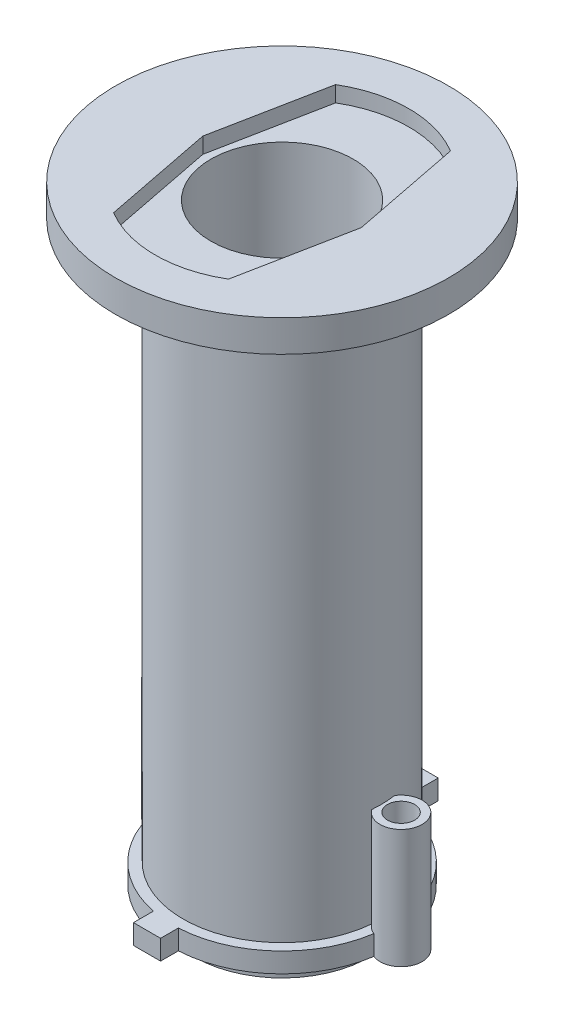
from build123d import *

# Parameters (mm, degrees)
BOSS_EXTRUDE1_DEPTH = 2.5
CUT_EXTRUDE1_REACH  = 26.645
SKETCH2_R           = 1.715
SKETCH2_R_2         = 8.98
SKETCH3_R           = 2.6543
BOSS_EXTRUDE2_DEPTH = 70.305
BOSS_EXTRUDE3_START = 4
SKETCH4_R           = 21
SKETCH4_R_2         = 8.98
BOSS_EXTRUDE3_DEPTH = 4
SKETCH6_R           = 21
SKETCH6_R_2         = 8.98
BOSS_EXTRUDE4_DEPTH = 2
CUT_EXTRUDE3_START  = -15
SKETCH7_R           = 1.715
CUT_EXTRUDE3_DEPTH  = 15
SKETCH8_R           = 8.98
CUT_EXTRUDE4_DEPTH  = 2
SKETCH9_R           = 11.0744
SKETCH9_R_2         = 8.98
BOSS_EXTRUDE5_DEPTH = 2.35
BOSS_EXTRUDE6_REACH = 82.451
SKETCH10_R          = 12.48
SKETCH10_R_2        = 8.98
SKETCH12_R          = 21
SKETCH12_R_2        = 12.48
CUT_EXTRUDE5_DEPTH  = 57.805


with BuildPart() as part:
    # Sketch1 → Boss-Extrude1 (new body)
    with BuildSketch(Plane(origin=(0, 0, 0), x_dir=(1, 0, 0), z_dir=(0, 1, 0))):
        with BuildLine():
            Line((0.597960958, 12.236443242), (0.597960958, 17.5133))
            Line((0.597960958, 17.5133), (-2.819411684, 17.5133))
            Line((-2.819411684, 17.5133), (-2.819411684, 11.976881697))
            ThreePointArc((-2.819411684, 11.976881697), (-9.752212861, 8.278991937), (-13.533031252, 1.391065316))
            ThreePointArc((-13.533031252, 1.391065316), (-17.156497956, -0.999626805), (-13.683409812, -3.603965207))
            ThreePointArc((-13.683409812, -3.603965207), (-10.042516815, -11.01106651), (-2.819411684, -15.004561697))
            Line((-2.819411684, -15.004561697), (-2.819411684, -17.5133))
            Line((-2.819411684, -17.5133), (0.597960958, -17.5133))
            Line((0.597960958, -17.5133), (0.597960958, -15.264123242))
            ThreePointArc((0.597960958, -15.264123242), (9.161591247, -11.721092084), (13.538839655, -3.55233882))
            ThreePointArc((13.538839655, -3.55233882), (17.156522938, -1.000460972), (13.393344487, 1.331534062))
            ThreePointArc((13.393344487, 1.331534062), (8.853545908, 8.96396608), (0.597960958, 12.236443242))
        make_face()
    extrude(amount=BOSS_EXTRUDE1_DEPTH)

    # Sketch2 → Cut-Extrude1 (cut, up to next)
    with BuildSketch(Plane(origin=(0, 2.5, 0), x_dir=(1, 0, 0), z_dir=(0, 1, 0)), mode=Mode.PRIVATE) as cut_extrude1_sk1:
        with Locations(Location((-14.5034, -1.0795, 0), (0, 0, 270))):
            Circle(SKETCH2_R)
    cut_extrude1_tool1 = extrude(cut_extrude1_sk1.sketch, amount=-CUT_EXTRUDE1_REACH, mode=Mode.PRIVATE) & part.part
    # Sketch2 → Cut-Extrude1 (cut, up to next)
    with BuildSketch(Plane(origin=(0, 2.5, 0), x_dir=(1, 0, 0), z_dir=(0, 1, 0)), mode=Mode.PRIVATE) as cut_extrude1_sk2:
        with Locations(Location((14.5034, -1.0795, 0), (0, 0, 270))):
            Circle(SKETCH2_R)
    cut_extrude1_tool2 = extrude(cut_extrude1_sk2.sketch, amount=-CUT_EXTRUDE1_REACH, mode=Mode.PRIVATE) & part.part
    # Sketch2 → Cut-Extrude1 (cut, up to next)
    with BuildSketch(Plane(origin=(0, 2.5, 0), x_dir=(1, 0, 0), z_dir=(0, 1, 0)), mode=Mode.PRIVATE) as cut_extrude1_sk3:
        with Locations(Location((-0.0762, -1.51384, 0), (0, 0, 270))):
            Circle(SKETCH2_R_2)
    cut_extrude1_tool3 = extrude(cut_extrude1_sk3.sketch, amount=-CUT_EXTRUDE1_REACH, mode=Mode.PRIVATE) & part.part
    add(cut_extrude1_tool1.solids().sort_by_distance((-14.5034, 2.5, 1.0795))[0], mode=Mode.SUBTRACT)
    add(cut_extrude1_tool2.solids().sort_by_distance((14.5034, 2.5, 1.0795))[0], mode=Mode.SUBTRACT)
    add(cut_extrude1_tool3.solids().sort_by_distance((-0.0762, 2.5, 1.51384))[0], mode=Mode.SUBTRACT)

    # Sketch3 → Boss-Extrude2 (add)
    with BuildSketch(Plane(origin=(0, 2.5, 0), x_dir=(1, 0, 0), z_dir=(0, 1, 0))):
        with Locations(Location((-14.5034, -1.0795, 0), (0, 0, 68.556492541))):
            Circle(SKETCH3_R)
        with Locations(Location((14.5034, -1.0795, 0), (0, 0, 114.72164566))):
            Circle(SKETCH3_R)
    extrude(amount=BOSS_EXTRUDE2_DEPTH)

    # Sketch4 → Boss-Extrude3 (add)
    with BuildSketch(Plane(origin=(0, 72.805, 0), x_dir=(1, 0, 0), z_dir=(0, 1, 0)).offset(BOSS_EXTRUDE3_START)):
        with Locations(Location((-0.0762, -1.51384, 0), (0, 0, 270))):
            Circle(SKETCH4_R)
        with Locations(Location((-0.0762, -1.51384, 0), (0, 0, 270))):
            Circle(SKETCH4_R_2, mode=Mode.SUBTRACT)
    extrude(amount=-BOSS_EXTRUDE3_DEPTH)

    # Sketch6 → Boss-Extrude4 (add)
    with BuildSketch(Plane(origin=(0, 37.805, 0), x_dir=(-1, 0, 0), z_dir=(0, -1, 0))):
        with Locations(Location((0.0762, -1.51384, 0), (0, 0, 90))):
            Circle(SKETCH6_R)
        with Locations(Location((0.0762, -1.51384, 0), (0, 0, 270))):
            Circle(SKETCH6_R_2, mode=Mode.SUBTRACT)
    extrude(amount=BOSS_EXTRUDE4_DEPTH)

    # Sketch7 → Cut-Extrude3 (cut)
    with BuildSketch(Plane.XZ.offset(CUT_EXTRUDE3_START)):
        with Locations(Location((-14.5034, 1.0795, 0), (0, 0, 90))):
            Circle(SKETCH7_R)
        with Locations(Location((14.5034, 1.0795, 0), (0, 0, 90))):
            Circle(SKETCH7_R)
    extrude(amount=CUT_EXTRUDE3_DEPTH, mode=Mode.SUBTRACT)

    # Sketch8 → Cut-Extrude4 (cut)
    with BuildSketch(Plane(origin=(0, 76.805, 0), x_dir=(1, 0, 0), z_dir=(0, 1, 0))):
        with BuildLine():
            Line((-10.0762, -1.51384), (-7.3262, -15.51384))
            ThreePointArc((-7.3262, -15.51384), (-0.0762, -17.51384), (7.1738, -15.51384))
            Line((7.1738, -15.51384), (9.9238, -1.51384))
            Line((9.9238, -1.51384), (7.1738, 12.48616))
            ThreePointArc((7.1738, 12.48616), (-0.0762, 14.48616), (-7.3262, 12.48616))
            Line((-7.3262, 12.48616), (-10.0762, -1.51384))
        make_face()
        with Locations(Location((-0.0762, -1.51384, 0), (0, 0, 270))):
            Circle(SKETCH8_R, mode=Mode.SUBTRACT)
    extrude(amount=-CUT_EXTRUDE4_DEPTH, mode=Mode.SUBTRACT)

    # Sketch9 → Boss-Extrude5 (add)
    with BuildSketch(Plane.XZ):
        with Locations(Location((-0.0762, 1.51384, 0), (0, 0, 90))):
            Circle(SKETCH9_R)
        with Locations(Location((-0.0762, 1.51384, 0), (0, 0, 90))):
            Circle(SKETCH9_R_2, mode=Mode.SUBTRACT)
    extrude(amount=BOSS_EXTRUDE5_DEPTH)

    # Boss-Extrude6: up to this face of the body (flat: up to its plane)
    boss_extrude6_end = Plane(part.part.faces().sort_by_distance((-0.0762, 72.805, -18.892190304))[0])
    # Sketch10 → Boss-Extrude6 (add, up to the picked face)
    with BuildSketch(Plane(origin=(0, 2.5, 0), x_dir=(1, 0, 0), z_dir=(0, 1, 0)), mode=Mode.PRIVATE) as boss_extrude6_sk1:
        with Locations((-0.0762, -1.51384)):
            Circle(SKETCH10_R)
        with Locations(Location((-0.0762, -1.51384, 0), (0, 0, 270))):
            Circle(SKETCH10_R_2, mode=Mode.SUBTRACT)
    boss_extrude6_tool1 = split(extrude(boss_extrude6_sk1.sketch, amount=BOSS_EXTRUDE6_REACH, mode=Mode.PRIVATE), bisect_by=boss_extrude6_end, keep=Keep.BOTH, mode=Mode.PRIVATE)
    add(boss_extrude6_tool1.solids().sort_by(Axis((-12.203212, 2.5, 1.51384), (0, 1, 0)))[0])

    # Sketch12 → Cut-Extrude5 (cut)
    with BuildSketch(Plane.XZ.offset(-15)):
        with Locations(Location((-0.0762, 1.51384, 0), (0, 0, 90))):
            Circle(SKETCH12_R)
        with Locations(Location((-0.0762, 1.51384, 0), (0, 0, 189.400360909))):
            Circle(SKETCH12_R_2, mode=Mode.SUBTRACT)
    extrude(amount=-CUT_EXTRUDE5_DEPTH, mode=Mode.SUBTRACT)


solid = part.part
